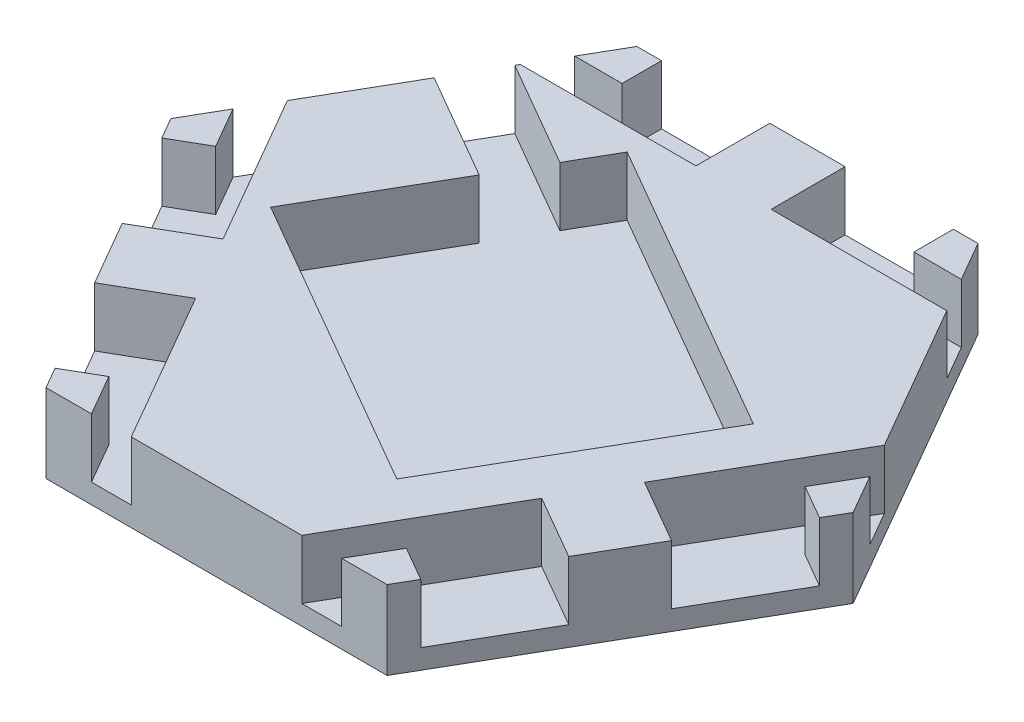
from build123d import *

# Parameters (mm, degrees)
BOSS_EXTRUDE1_DEPTH     = 16
SKETCH2_W               = 22
SKETCH2_H               = 15
CUT_EXTRUDE1_DEPTH      = 12
CUT_EXTRUDE2_DEPTH      = 94.037626797
CUT_EXTRUDE2_DEPTH_BACK = 12
CUT_EXTRUDE4_DEPTH      = 12


with BuildPart() as part:
    # Sketch1 → Boss-Extrude1 (new body)
    with BuildSketch(Plane(origin=(0, 0, 0), x_dir=(1, 0, 0), z_dir=(0, 1, 0))):
        Polygon((69.282032303, 0), (34.641016151, 60), (-34.641016151, 60), (-69.282032303, 0), (-34.641016151, -60), (34.641016151, -60), align=None)
    extrude(amount=BOSS_EXTRUDE1_DEPTH)

    # Sketch2 → Cut-Extrude1 (cut)
    with BuildSketch(Plane(origin=(0, 16, 0), x_dir=(1, 0, 0), z_dir=(0, 1, 0))):
        with Locations((-18.641016151, 52.5)):
            Rectangle(SKETCH2_W, SKETCH2_H)
        with Locations((18.641016151, 52.5)):
            Rectangle(SKETCH2_W, SKETCH2_H)
        Polygon((66.782032303, -4.330127019), (53.791651246, 3.169872981), (42.791651246, -15.882685902), (55.782032303, -23.382685902), align=None)
        Polygon((48.141016151, -36.617314098), (35.150635095, -29.117314098), (24.150635095, -48.169872981), (37.141016151, -55.669872981), align=None)
        Polygon((-37.141016151, -55.669872981), (-24.150635095, -48.169872981), (-35.150635095, -29.117314098), (-48.141016151, -36.617314098), align=None)
        Polygon((-55.782032303, -23.382685902), (-42.791651246, -15.882685902), (-53.791651246, 3.169872981), (-66.782032303, -4.330127019), align=None)
    extrude(amount=-CUT_EXTRUDE1_DEPTH, mode=Mode.SUBTRACT)

    # Sketch3 → Cut-Extrude2 (cut, two sides: drawn at the far end of the back side and taken through both)
    with BuildSketch(Plane(origin=(0, 16, 0), x_dir=(1, 0, 0), z_dir=(0, 1, 0)).offset(-CUT_EXTRUDE2_DEPTH_BACK)):
        Polygon((-43.560889132, -5.4496732), (17.060889132, -40.4496732), (43.560889132, 5.4496732), (-17.060889132, 40.4496732), align=None)
        Polygon((-22.060889132, 31.789419162), (-28.060889132, 21.397114317), (-49.711524227, 33.897114317), (-43.711524227, 44.289419162), align=None)
    extrude(amount=CUT_EXTRUDE2_DEPTH + CUT_EXTRUDE2_DEPTH_BACK, mode=Mode.SUBTRACT)

    # Sketch4 → Cut-Extrude4 (cut)
    with BuildSketch(Plane(origin=(0, 16, 0), x_dir=(1, 0, 0), z_dir=(0, 1, 0))):
        Polygon((-53.791651246, 3.169872981), (-59.853829072, -0.330127019), (-64.663230149, 8), (-60.621778265, 15), align=None)
        Polygon((-24.150635095, -48.169872981), (-30.212812921, -51.669872981), (-25.403411844, -60), (-17.320508076, -60), align=None)
        Polygon((43.301270189, 45), (29.641016151, 45), (29.641016151, 52), (39.259818305, 52), align=None)
        Polygon((-43.301270189, 45), (-29.641016151, 45), (-29.641016151, 52), (-39.259818305, 52), align=None)
        Polygon((17.320508076, -60), (24.150635095, -48.169872981), (30.212812921, -51.669872981), (25.403411844, -60), align=None)
        Polygon((60.621778265, 15), (53.791651246, 3.169872981), (59.853829072, -0.330127019), (64.663230149, 8), align=None)
    extrude(amount=-CUT_EXTRUDE4_DEPTH, mode=Mode.SUBTRACT)


solid = part.part
